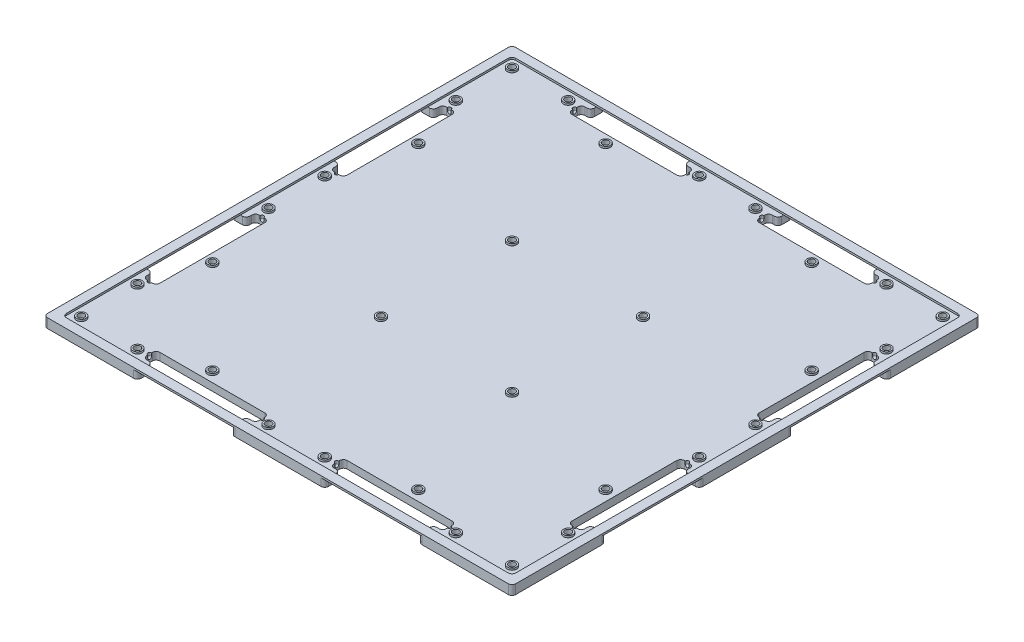
from build123d import *

# Parameters (mm, degrees)
SKETCH1_W                       = 250
SKETCH1_H                       = 250
BOSS_EXTRUDE1_DEPTH             = 2
SKETCH2_W                       = 240
SKETCH2_H                       = 240
CUT_EXTRUDE1_DEPTH              = 1
CUT_EXTRUDE2_DEPTH              = 177.802149308
CIRPATTERN1_COUNT               = 4
SKETCH14_R                      = 2.5
BOSS_EXTRUDE2_DEPTH             = 1
SKETCH19_W                      = 200
SKETCH19_H                      = 200
BOSS_EXTRUDE3_DEPTH             = 1
BOSS_EXTRUDE4_DEPTH             = 1
CBORE_FOR_M3_SBHCS2_D           = 3.4
CBORE_FOR_M3_SBHCS2_CBORE_D     = 5.5
CBORE_FOR_M3_SBHCS2_CBORE_DEPTH = 1
FILLET2_R                       = 2
FILLET3_R                       = 10


with BuildPart() as part:
    # Sketch1 → Boss-Extrude1 (new, symmetric)
    with BuildSketch(Plane(origin=(0, 0, 0), x_dir=(1, 0, 0), z_dir=(0, 1, 0))):
        Rectangle(SKETCH1_W, SKETCH1_H)
    extrude(amount=BOSS_EXTRUDE1_DEPTH, both=True)

    # Sketch2 → Cut-Extrude1 (cut)
    with BuildSketch(Plane(origin=(0, 2, 0), x_dir=(1, 0, 0), z_dir=(0, 1, 0))):
        Rectangle(SKETCH2_W, SKETCH2_H)
    extrude(amount=-CUT_EXTRUDE1_DEPTH, mode=Mode.SUBTRACT)

    # Sketch9 → Cut-Extrude2 (cut, through all)
    with BuildSketch(Plane(origin=(0, 1, 0), x_dir=(1, 0, 0), z_dir=(0, 1, 0))):
        Polygon((75, 117), (80, 117), (80, 110), (20, 110), (20, 117), (25, 117), (25, 125), (75, 125), align=None)
        Polygon((-25, 125), (-75, 125), (-75, 117), (-80, 117), (-80, 110), (-20, 110), (-20, 117), (-25, 117), align=None)
    cut_extrude2 = extrude(amount=-CUT_EXTRUDE2_DEPTH, mode=Mode.SUBTRACT)

    # Sketch12 → Cut-Revolve1 (revolve, cut)
    with BuildSketch(Plane.ZY.offset(-80)):
        with BuildLine():
            Line((-113.5, 1), (-113.5, -1.5))
            ThreePointArc((-113.5, -1.5), (-112.792893219, -1.207106781), (-112.5, -0.5))
            Line((-112.5, -0.5), (-112.5, 1))
            Line((-112.5, 1), (-113.5, 1))
        make_face()
    cut_revolve1 = revolve(axis=Axis((80, 1, -113.5), (0, -1, 0)), mode=Mode.SUBTRACT)

    # Mirror1: Cut-Revolve1 across plane
    add(cut_revolve1.mirror(Plane(origin=(50, 0, 0), x_dir=(0, 0, 1), z_dir=(1, 0, 0))), mode=Mode.SUBTRACT)

    # Mirror2: Cut-Revolve1 across plane
    add(cut_revolve1.mirror(Plane(origin=(0, 0, 0), x_dir=(0, 0, 1), z_dir=(1, 0, 0))), mode=Mode.SUBTRACT)

    # Mirror2 copy 1 sketch → Mirror2 copy 1 (revolve, cut)
    with BuildSketch(Plane.ZY.offset(20)):
        with BuildLine():
            Line((-113.5, 1), (-113.5, -1.5))
            ThreePointArc((-113.5, -1.5), (-112.792893219, -1.207106781), (-112.5, -0.5))
            Line((-112.5, -0.5), (-112.5, 1))
            Line((-112.5, 1), (-113.5, 1))
        make_face()
    revolve(axis=Axis((-20, 1, -113.5), (0, -1, 0)), mode=Mode.SUBTRACT)

    # CirPattern1: Cut-Extrude2, Cut-Revolve1 ×4 about axis
    cirpattern1_axis = Axis((0, 0, 0), (0, 1, 0))
    add([cut_extrude2.rotate(cirpattern1_axis, i * 360 / CIRPATTERN1_COUNT) for i in range(1, CIRPATTERN1_COUNT)], mode=Mode.SUBTRACT)
    add([cut_revolve1.rotate(cirpattern1_axis, i * 360 / CIRPATTERN1_COUNT) for i in range(1, CIRPATTERN1_COUNT)], mode=Mode.SUBTRACT)

    # CirPattern1 copy 1 sketch → CirPattern1 copy 1 (revolve, cut)
    with BuildSketch(Plane(origin=(0, 0, -20), x_dir=(1, 0, 0), z_dir=(0, 0, -1))):
        with BuildLine():
            Line((-113.5, -1), (-113.5, 1.5))
            ThreePointArc((-113.5, 1.5), (-112.792893219, 1.207106781), (-112.5, 0.5))
            Line((-112.5, 0.5), (-112.5, -1))
            Line((-112.5, -1), (-113.5, -1))
        make_face()
    revolve(axis=Axis((-113.5, 1, -20), (0, 1, 0)), mode=Mode.SUBTRACT)

    # CirPattern1 copy 2 sketch → CirPattern1 copy 2 (revolve, cut)
    with BuildSketch(Plane(origin=(-20, 0, 0), x_dir=(0, 0, -1), z_dir=(-1, 0, 0))):
        with BuildLine():
            Line((-113.5, -1), (-113.5, 1.5))
            ThreePointArc((-113.5, 1.5), (-112.792893219, 1.207106781), (-112.5, 0.5))
            Line((-112.5, 0.5), (-112.5, -1))
            Line((-112.5, -1), (-113.5, -1))
        make_face()
    revolve(axis=Axis((-20, 1, 113.5), (0, 1, 0)), mode=Mode.SUBTRACT)

    # CirPattern1 copy 3 sketch → CirPattern1 copy 3 (revolve, cut)
    with BuildSketch(Plane(origin=(0, 0, 20), x_dir=(-1, 0, 0), z_dir=(0, 0, 1))):
        with BuildLine():
            Line((-113.5, -1), (-113.5, 1.5))
            ThreePointArc((-113.5, 1.5), (-112.792893219, 1.207106781), (-112.5, 0.5))
            Line((-112.5, 0.5), (-112.5, -1))
            Line((-112.5, -1), (-113.5, -1))
        make_face()
    revolve(axis=Axis((113.5, 1, 20), (0, 1, 0)), mode=Mode.SUBTRACT)

    # CirPattern1 copy 4 sketch → CirPattern1 copy 4 (revolve, cut)
    with BuildSketch(Plane(origin=(0, 0, 80), x_dir=(1, 0, 0), z_dir=(0, 0, -1))):
        with BuildLine():
            Line((-113.5, -1), (-113.5, 1.5))
            ThreePointArc((-113.5, 1.5), (-112.792893219, 1.207106781), (-112.5, 0.5))
            Line((-112.5, 0.5), (-112.5, -1))
            Line((-112.5, -1), (-113.5, -1))
        make_face()
    revolve(axis=Axis((-113.5, 1, 80), (0, 1, 0)), mode=Mode.SUBTRACT)

    # CirPattern1 copy 5 sketch → CirPattern1 copy 5 (revolve, cut)
    with BuildSketch(Plane(origin=(80, 0, 0), x_dir=(0, 0, -1), z_dir=(-1, 0, 0))):
        with BuildLine():
            Line((-113.5, -1), (-113.5, 1.5))
            ThreePointArc((-113.5, 1.5), (-112.792893219, 1.207106781), (-112.5, 0.5))
            Line((-112.5, 0.5), (-112.5, -1))
            Line((-112.5, -1), (-113.5, -1))
        make_face()
    revolve(axis=Axis((80, 1, 113.5), (0, 1, 0)), mode=Mode.SUBTRACT)

    # CirPattern1 copy 6 sketch → CirPattern1 copy 6 (revolve, cut)
    with BuildSketch(Plane(origin=(0, 0, -80), x_dir=(-1, 0, 0), z_dir=(0, 0, 1))):
        with BuildLine():
            Line((-113.5, -1), (-113.5, 1.5))
            ThreePointArc((-113.5, 1.5), (-112.792893219, 1.207106781), (-112.5, 0.5))
            Line((-112.5, 0.5), (-112.5, -1))
            Line((-112.5, -1), (-113.5, -1))
        make_face()
    revolve(axis=Axis((113.5, 1, -80), (0, 1, 0)), mode=Mode.SUBTRACT)

    # CirPattern1 copy 7 sketch → CirPattern1 copy 7 (revolve, cut)
    with BuildSketch(Plane.XY.offset(20)):
        with BuildLine():
            Line((-113.5, 1), (-113.5, -1.5))
            ThreePointArc((-113.5, -1.5), (-112.792893219, -1.207106781), (-112.5, -0.5))
            Line((-112.5, -0.5), (-112.5, 1))
            Line((-112.5, 1), (-113.5, 1))
        make_face()
    revolve(axis=Axis((-113.5, 1, 20), (0, -1, 0)), mode=Mode.SUBTRACT)

    # CirPattern1 copy 8 sketch → CirPattern1 copy 8 (revolve, cut)
    with BuildSketch(Plane(origin=(20, 0, 0), x_dir=(0, 0, -1), z_dir=(1, 0, 0))):
        with BuildLine():
            Line((-113.5, 1), (-113.5, -1.5))
            ThreePointArc((-113.5, -1.5), (-112.792893219, -1.207106781), (-112.5, -0.5))
            Line((-112.5, -0.5), (-112.5, 1))
            Line((-112.5, 1), (-113.5, 1))
        make_face()
    revolve(axis=Axis((20, 1, 113.5), (0, -1, 0)), mode=Mode.SUBTRACT)

    # CirPattern1 copy 9 sketch → CirPattern1 copy 9 (revolve, cut)
    with BuildSketch(Plane(origin=(0, 0, -20), x_dir=(-1, 0, 0), z_dir=(0, 0, -1))):
        with BuildLine():
            Line((-113.5, 1), (-113.5, -1.5))
            ThreePointArc((-113.5, -1.5), (-112.792893219, -1.207106781), (-112.5, -0.5))
            Line((-112.5, -0.5), (-112.5, 1))
            Line((-112.5, 1), (-113.5, 1))
        make_face()
    revolve(axis=Axis((113.5, 1, -20), (0, -1, 0)), mode=Mode.SUBTRACT)

    # Sketch14 → Boss-Extrude2 (add)
    with BuildSketch(Plane(origin=(0, 1, 0), x_dir=(1, 0, 0), z_dir=(0, 1, 0))):
        with Locations(Location((-15, -115, 0), (0, 0, 90))):
            Circle(SKETCH14_R)
        with Locations(Location((-85, -115, 0), (0, 0, 90))):
            Circle(SKETCH14_R)
        with Locations(Location((-115, -115, 0), (0, 0, 90))):
            Circle(SKETCH14_R)
        with Locations(Location((-55, -105, 0), (0, 0, 90))):
            Circle(SKETCH14_R)
        with Locations(Location((-35, 35, 0), (0, 0, 90))):
            Circle(SKETCH14_R)
        with Locations(Location((-35, -35, 0), (0, 0, 90))):
            Circle(SKETCH14_R)
        with Locations(Location((35, -35, 0), (0, 0, 90))):
            Circle(SKETCH14_R)
        with Locations(Location((35, 35, 0), (0, 0, 90))):
            Circle(SKETCH14_R)
        with Locations(Location((15, -115, 0), (0, 0, 90))):
            Circle(SKETCH14_R)
        with Locations(Location((55, -105, 0), (0, 0, 90))):
            Circle(SKETCH14_R)
        with Locations(Location((85, -115, 0), (0, 0, 90))):
            Circle(SKETCH14_R)
        with Locations(Location((-115, 115, 0), (0, 0, 90))):
            Circle(SKETCH14_R)
        with Locations(Location((-115, 85, 0), (0, 0, 90))):
            Circle(SKETCH14_R)
        with Locations(Location((-105, 55, 0), (0, 0, 90))):
            Circle(SKETCH14_R)
        with Locations(Location((-115, 15, 0), (0, 0, 90))):
            Circle(SKETCH14_R)
        with Locations(Location((-115, -15, 0), (0, 0, 90))):
            Circle(SKETCH14_R)
        with Locations(Location((-105, -55, 0), (0, 0, 90))):
            Circle(SKETCH14_R)
        with Locations(Location((-115, -85, 0), (0, 0, 90))):
            Circle(SKETCH14_R)
        with Locations(Location((115, 115, 0), (0, 0, 90))):
            Circle(SKETCH14_R)
        with Locations(Location((85, 115, 0), (0, 0, 90))):
            Circle(SKETCH14_R)
        with Locations(Location((55, 105, 0), (0, 0, 90))):
            Circle(SKETCH14_R)
        with Locations(Location((15, 115, 0), (0, 0, 90))):
            Circle(SKETCH14_R)
        with Locations(Location((-15, 115, 0), (0, 0, 90))):
            Circle(SKETCH14_R)
        with Locations(Location((-55, 105, 0), (0, 0, 90))):
            Circle(SKETCH14_R)
        with Locations(Location((-85, 115, 0), (0, 0, 90))):
            Circle(SKETCH14_R)
        with Locations(Location((115, -115, 0), (0, 0, 90))):
            Circle(SKETCH14_R)
        with Locations(Location((115, -85, 0), (0, 0, 90))):
            Circle(SKETCH14_R)
        with Locations(Location((105, -55, 0), (0, 0, 90))):
            Circle(SKETCH14_R)
        with Locations(Location((115, -15, 0), (0, 0, 90))):
            Circle(SKETCH14_R)
        with Locations(Location((115, 15, 0), (0, 0, 90))):
            Circle(SKETCH14_R)
        with Locations(Location((105, 55, 0), (0, 0, 90))):
            Circle(SKETCH14_R)
        with Locations(Location((115, 85, 0), (0, 0, 90))):
            Circle(SKETCH14_R)
    extrude(amount=BOSS_EXTRUDE2_DEPTH)

    # Sketch19 → Boss-Extrude3 (add)
    with BuildSketch(Plane.XZ.offset(2)):
        Polygon((117, -25), (125, -25), (125, 25), (117, 25), (117, 20), (110, 20), (110, 80), (117, 80), (117, 75), (125, 75), (125, 125), (75, 125), (75, 117), (80, 117), (80, 110), (20, 110), (20, 117), (25, 117), (25, 125), (-25, 125), (-25, 117), (-20, 117), (-20, 110), (-80, 110), (-80, 117), (-75, 117), (-75, 125), (-125, 125), (-125, 75), (-117, 75), (-117, 80), (-110, 80), (-110, 20), (-117, 20), (-117, 25), (-125, 25), (-125, -25), (-117, -25), (-117, -20), (-110, -20), (-110, -80), (-117, -80), (-117, -75), (-125, -75), (-125, -125), (-75, -125), (-75, -117), (-80, -117), (-80, -110), (-20, -110), (-20, -117), (-25, -117), (-25, -125), (25, -125), (25, -117), (20, -117), (20, -110), (80, -110), (80, -117), (75, -117), (75, -125), (125, -125), (125, -75), (117, -75), (117, -80), (110, -80), (110, -20), (117, -20), align=None)
        Rectangle(SKETCH19_W, SKETCH19_H, mode=Mode.SUBTRACT)
    extrude(amount=BOSS_EXTRUDE3_DEPTH)

    # Sketch20 → Boss-Extrude4 (add)
    with BuildSketch(Plane.XZ.offset(2)):
        Polygon((33.377132403, -47.810889132), (58.094010768, -5), (100, -5), (100, 5), (58.094010768, 5), (33.377132403, 47.810889132), (63.508529611, 100), (51.961524227, 100), (24.716878365, 52.810889132), (-24.716878365, 52.810889132), (-51.961524227, 100), (-63.508529611, 100), (-33.377132403, 47.810889132), (-58.094010768, 5), (-100, 5), (-100, -5), (-58.094010768, -5), (-33.377132403, -47.810889132), (-63.508529611, -100), (-51.961524227, -100), (-24.716878365, -52.810889132), (24.716878365, -52.810889132), (51.961524227, -100), (63.508529611, -100), align=None)
        Polygon((-49.43375673, 0), (-24.716878365, -42.810889132), (24.716878365, -42.810889132), (49.43375673, 0), (24.716878365, 42.810889132), (-24.716878365, 42.810889132), align=None, mode=Mode.SUBTRACT)
    extrude(amount=BOSS_EXTRUDE4_DEPTH)

    # CBORE for M3 SBHCS2 (through all)
    with Locations(Plane(origin=(-115, -3, 115), x_dir=(0, 0, -1), z_dir=(0, -1, 0))):
        with Locations((0, 0), (30, 0), (60, 10), (0, 30), (10, 60), (0, 100), (0, 130), (10, 170), (0, 200), (0, 230), (30, 230), (60, 220), (80, 150), (80, 80), (100, 0), (130, 0), (170, 10), (200, 0), (230, 0), (230, 30), (220, 60), (230, 100), (230, 130), (220, 170), (230, 200), (230, 230), (200, 230), (170, 220), (130, 230), (100, 230), (150, 150), (150, 80)):
            CounterBoreHole(CBORE_FOR_M3_SBHCS2_D / 2, CBORE_FOR_M3_SBHCS2_CBORE_D / 2, CBORE_FOR_M3_SBHCS2_CBORE_DEPTH)

    # Fillet2
    fillet2_edges = [part.edges().sort_by_distance(p)[0] for p in [
        (120, 1.5, -120),
        (120, 1.5, 120),
        (125, -1, -25),
        (117, -1, -25),
        (117, -1, -20),
        (110, -1, -20),
        (110, -1, -80),
        (117, -1, -80),
        (117, -1, -75),
        (125, -1, -75),
        (-120, 1.5, 120),
        (-120, 1.5, -120),
        (125, -1, 75),
        (117, -1, 75),
        (117, -1, 80),
        (110, -1, 80),
        (110, -1, 20),
        (117, -1, 20),
        (117, -1, 25),
        (125, -1, 25),
        (25, -1, 125),
        (25, -1, 117),
        (20, -1, 117),
        (20, -1, 110),
        (80, -1, 110),
        (80, -1, 117),
        (75, -1, 117),
        (75, -1, 125),
        (-75, -1, 125),
        (-75, -1, 117),
        (-80, -1, 117),
        (-80, -1, 110),
        (-20, -1, 110),
        (-20, -1, 117),
        (-25, -1, 117),
        (-25, -1, 125),
        (-125, -1, 25),
        (-117, -1, 25),
        (-117, -1, 20),
        (-110, -1, 20),
        (-110, -1, 80),
        (-117, -1, 80),
        (-117, -1, 75),
        (-125, -1, 75),
        (-125, -1, -75),
        (-117, -1, -75),
        (-117, -1, -80),
        (-110, -1, -80),
        (-110, -1, -20),
        (-117, -1, -20),
        (-117, -1, -25),
        (-125, -1, -25),
        (75, -1, -125),
        (75, -1, -117),
        (80, -1, -117),
        (80, -1, -110),
        (20, -1, -110),
        (20, -1, -117),
        (25, -1, -117),
        (25, -1, -125),
        (-25, -1, -125),
        (-25, -1, -117),
        (-20, -1, -117),
        (-20, -1, -110),
        (-80, -1, -110),
        (-80, -1, -117),
        (-75, -1, -117),
        (-75, -1, -125),
        (125, -0.5, 125),
        (-125, -0.5, 125),
        (-125, -0.5, -125),
        (125, -0.5, -125),
    ]]
    fillet(fillet2_edges, radius=FILLET2_R)

    # Fillet3
    fillet3_edges = [part.edges().sort_by_distance(p)[0] for p in [
        (100, -2.5, 100),
        (-100, -2.5, 100),
        (-100, -2.5, -100),
        (100, -2.5, -100),
        (51.961524227, -2.5, -100),
        (24.716878365, -2.5, -52.810889132),
        (-24.716878365, -2.5, -52.810889132),
        (-51.961524227, -2.5, -100),
        (-63.508529611, -2.5, -100),
        (-33.377132403, -2.5, -47.810889132),
        (-58.094010768, -2.5, -5),
        (-100, -2.5, -5),
        (-100, -2.5, 5),
        (-58.094010768, -2.5, 5),
        (-33.377132403, -2.5, 47.810889132),
        (-63.508529611, -2.5, 100),
        (-51.961524227, -2.5, 100),
        (-24.716878365, -2.5, 52.810889132),
        (24.716878365, -2.5, 52.810889132),
        (51.961524227, -2.5, 100),
        (63.508529611, -2.5, 100),
        (33.377132403, -2.5, 47.810889132),
        (58.094010768, -2.5, 5),
        (100, -2.5, 5),
        (100, -2.5, -5),
        (58.094010768, -2.5, -5),
        (33.377132403, -2.5, -47.810889132),
        (63.508529611, -2.5, -100),
        (-24.716878365, -2.5, 42.810889132),
        (24.716878365, -2.5, 42.810889132),
        (49.43375673, -2.5, 0),
        (24.716878365, -2.5, -42.810889132),
        (-24.716878365, -2.5, -42.810889132),
        (-49.43375673, -2.5, 0),
    ]]
    fillet(fillet3_edges, radius=FILLET3_R)


solid = part.part
